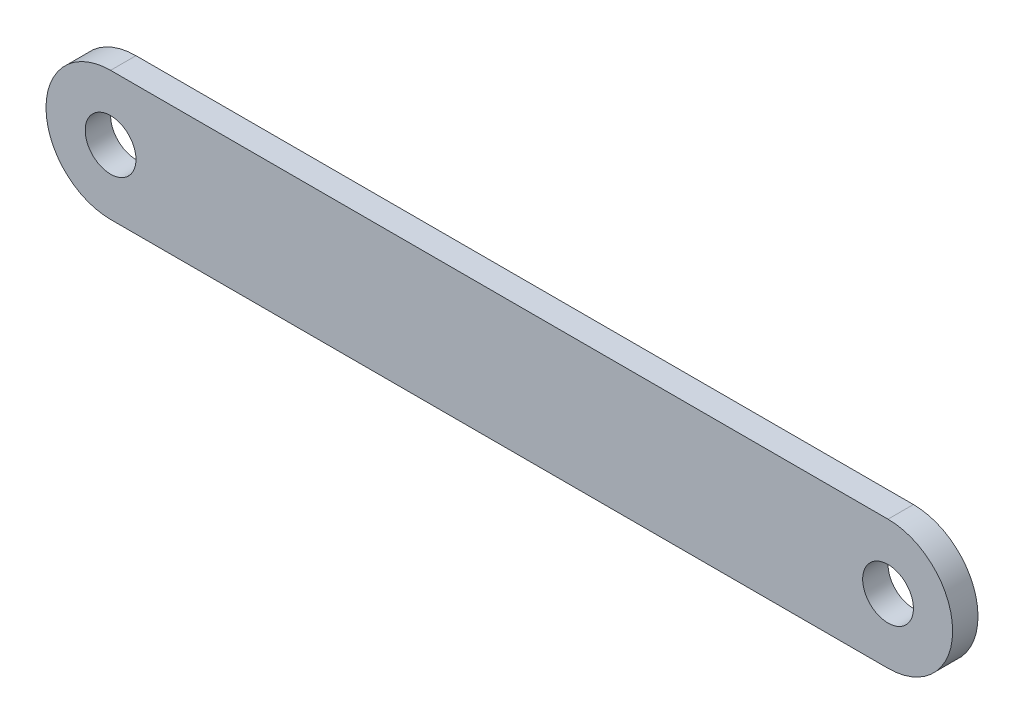
from build123d import *

# Parameters (mm, degrees)
ESBO_O1_R                = 1
RESSALTO_EXTRUS_O1_DEPTH = 1


with BuildPart() as part:
    # Esboço1 → Ressalto-extrusão1 (new body)
    with BuildSketch(Plane.XY):
        with BuildLine():
            Line((-15.315, 2.544778142), (15.315, 2.544778142))
            ThreePointArc((15.315, 2.544778142), (17.859778142, 0), (15.315, -2.544778142))
            Line((15.315, -2.544778142), (-15.315, -2.544778142))
            ThreePointArc((-15.315, -2.544778142), (-17.859778142, 0), (-15.315, 2.544778142))
        make_face()
        with Locations((-15.315, 0)):
            Circle(ESBO_O1_R, mode=Mode.SUBTRACT)
        with Locations((15.315, 0)):
            Circle(ESBO_O1_R, mode=Mode.SUBTRACT)
    extrude(amount=RESSALTO_EXTRUS_O1_DEPTH)


solid = part.part
